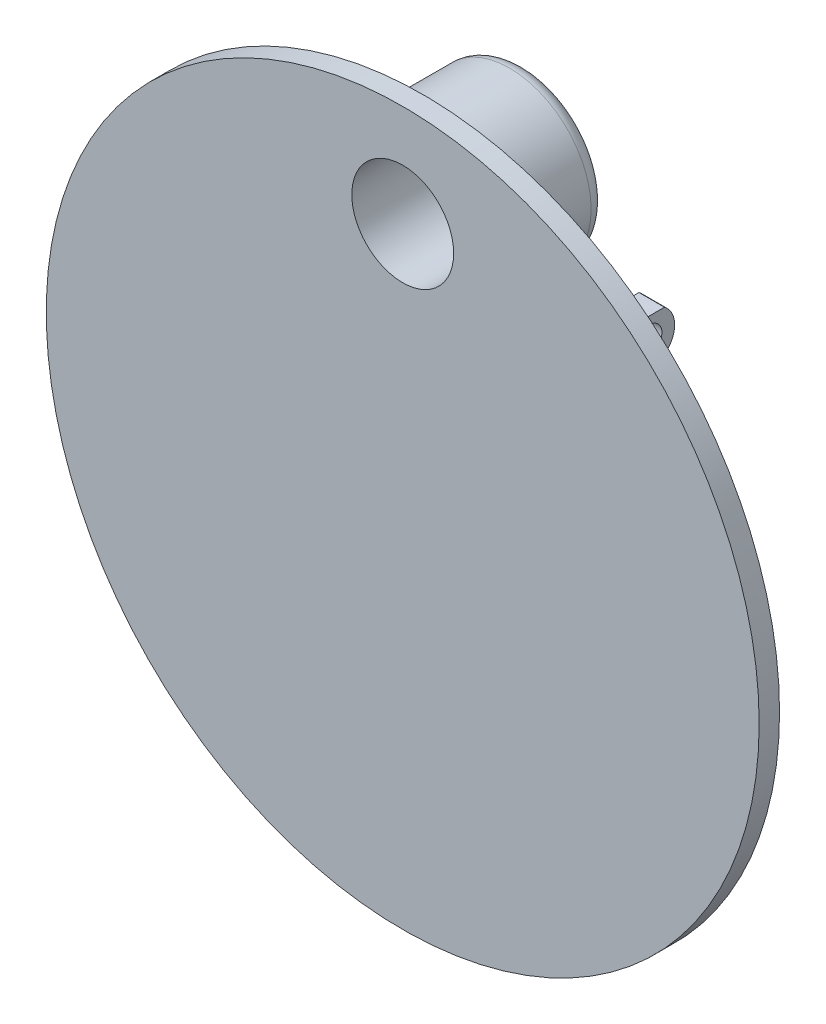
from build123d import *

# Parameters (mm, degrees)
SKETCH1_R           = 35
BOSS_EXTRUDE1_DEPTH = 2
SKETCH2_R           = 5
CUT_EXTRUDE2_DEPTH  = 2
SKETCH4_R           = 8
SKETCH4_R_2         = 5
BOSS_EXTRUDE3_DEPTH = 10
FILLET3_R           = 0.75
FILLET4_R           = 1.5
BOSS_EXTRUDE4_START = 0.2
BOSS_EXTRUDE4_DEPTH = 2.5
BOSS_EXTRUDE5_START = 2.7
BOSS_EXTRUDE5_DEPTH = 2.5
SKETCH7_R           = 1.25
CUT_EXTRUDE3_DEPTH  = 60.240948676


with BuildPart() as part:
    # Sketch1 → Boss-Extrude1 (new body)
    with BuildSketch(Plane.XY):
        Circle(SKETCH1_R)
    extrude(amount=BOSS_EXTRUDE1_DEPTH)

    # Sketch2 → Cut-Extrude2 (cut)
    with BuildSketch(Plane.XY.offset(2)):
        with Locations((0, 25)):
            Circle(SKETCH2_R)
    extrude(amount=-CUT_EXTRUDE2_DEPTH, mode=Mode.SUBTRACT)

    # Sketch4 → Boss-Extrude3 (add)
    with BuildSketch(Plane(origin=(0, 0, 0), x_dir=(-1, 0, 0), z_dir=(0, 0, -1))):
        with Locations(Location((0, 25, 0), (0, 0, 180))):
            Circle(SKETCH4_R)
        with Locations(Location((0, 25, 0), (0, 0, 180))):
            Circle(SKETCH4_R_2, mode=Mode.SUBTRACT)
    extrude(amount=BOSS_EXTRUDE3_DEPTH)

    # Fillet3
    fillet3_edges = [part.edges().sort_by_distance(p)[0] for p in [
        (-5, 25, -10),
    ]]
    fillet(fillet3_edges, radius=FILLET3_R)

    # Fillet4
    fillet4_edges = [part.edges().sort_by_distance(p)[0] for p in [
        (-8, 25, -10),
    ]]
    fillet(fillet4_edges, radius=FILLET4_R)

    # Sketch5 → Boss-Extrude4 (add)
    with BuildSketch(Plane(origin=(8, 0, 0), x_dir=(0, 0, -1), z_dir=(1, 0, 0)).offset(BOSS_EXTRUDE4_START)):
        with BuildLine():
            Line((13, 15.769174864), (0, 15.769174864))
            Line((0, 15.769174864), (0, 11.769174864))
            Line((0, 11.769174864), (10, 11.769174864))
            ThreePointArc((10, 11.769174864), (13.5, 12.269174864), (13, 15.769174864))
        make_face()
    extrude(amount=BOSS_EXTRUDE4_DEPTH)

    # Sketch6 → Boss-Extrude5 (add)
    with BuildSketch(Plane.ZY.offset(8).offset(BOSS_EXTRUDE5_START)):
        with BuildLine():
            Line((-10, 11.769174864), (0, 11.769174864))
            Line((0, 11.769174864), (0, 15.769174864))
            Line((0, 15.769174864), (-13, 15.769174864))
            ThreePointArc((-13, 15.769174864), (-13.5, 12.269174864), (-10, 11.769174864))
        make_face()
    extrude(amount=-BOSS_EXTRUDE5_DEPTH)

    # Sketch7 → Cut-Extrude3 (cut, through all)
    with BuildSketch(Plane.ZY.offset(10.7)):
        with Locations(Location((-11.5, 13.769174864, 0), (0, 0, 270))):
            Circle(SKETCH7_R)
    extrude(amount=-CUT_EXTRUDE3_DEPTH, mode=Mode.SUBTRACT)


solid = part.part
